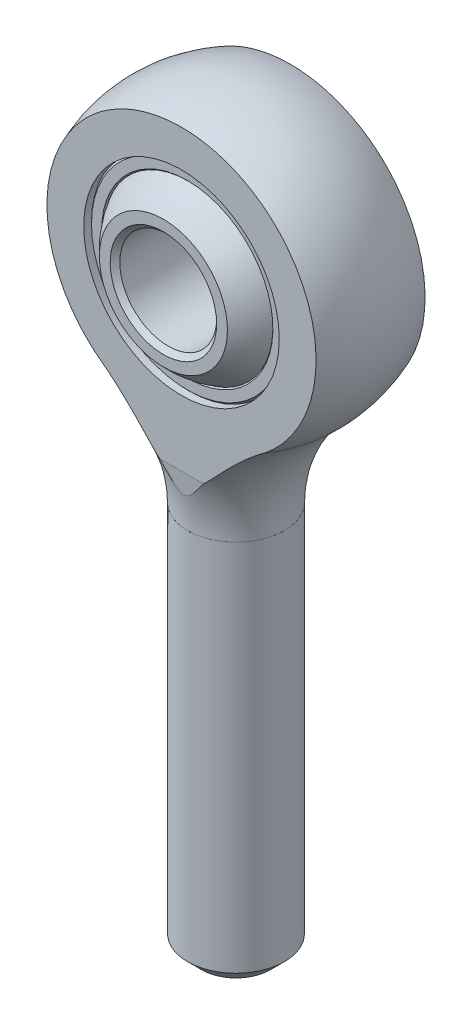
from build123d import *

# Parameters (mm, degrees)
SKETCH1_W               = 3.175
SKETCH1_H               = 25.4
CHAMFER2_SIZE           = 0.907142857
CUT_EXTRUDE1_DEPTH      = 29.750847814
CUT_EXTRUDE1_DEPTH_BACK = 29.750847814
CUT_EXTRUDE2_DEPTH      = 28.361772754
CUT_EXTRUDE2_DEPTH_BACK = 28.361772754
SKETCH6_R               = 6.4135
CUT_EXTRUDE3_DEPTH      = 28.86051193
CUT_EXTRUDE3_DEPTH_BACK = 28.86051193
SKETCH8_W               = 4.7625
SKETCH8_H               = 23.8125
CUT_EXTRUDE4_DEPTH      = 28.86051193
CUT_EXTRUDE4_DEPTH_BACK = 28.86051193
SKETCH10_R              = 3.175
CHAMFER1_SIZE           = 0.3175
CHAMFER3_SIZE           = 0.127
CHAMFER3_PART_2_SIZE    = 0.127
CHAMFER3_PART_2_SIZE2   = 0.092884709
CHAMFER4_SIZE           = 0.127
CHAMFER4_SIZE2          = 0.092884709
CHAMFER4_PART_2_SIZE    = 0.127


with BuildPart() as part:
    # Sketch1 → Revolve1 (revolve)
    with BuildSketch(Plane.XY):
        with Locations((1.5875, -12.7)):
            Rectangle(SKETCH1_W, SKETCH1_H)
    revolve(axis=Axis((0, 23.8125, 0), (0, -1, 0)))

    # Chamfer2
    chamfer2_edges = [part.edges().sort_by_distance(p)[0] for p in [
        (-3.175, -25.4, 0),
    ]]
    chamfer(chamfer2_edges, length=CHAMFER2_SIZE)


with BuildPart() as body_2:
    # Sketch4 → Revolve2 (revolve)
    with BuildSketch(Plane.XY):
        with BuildLine():
            Line((3.175, 0), (0, 0))
            Line((0, 0), (0, 23.8125))
            ThreePointArc((0, 23.8125), (8.890116899, 17.70677573), (6.382731959, 7.217396907))
            ThreePointArc((6.382731959, 7.217396907), (4.01304802, 3.949061991), (3.175, 0))
        make_face()
    revolve(axis=Axis((0, 23.8125, 0), (0, 1, 0)))

    # Sketch5 → Cut-Extrude1 (cut, two sides: drawn at the far end of the back side and taken through both)
    with BuildSketch(Plane(origin=(0, 0, 0), x_dir=(0, 0, -1), z_dir=(1, 0, 0)).offset(-CUT_EXTRUDE1_DEPTH_BACK)):
        Polygon((3.57505, 23.8125), (9.525, 23.8125), (9.525, 0), (3.175, 0), (3.57505, 3.57505), align=None)
        Polygon((-3.57505, 23.8125), (-3.57505, 3.57505), (-3.175, 0), (-9.525, 0), (-9.525, 23.8125), align=None)
    extrude(amount=CUT_EXTRUDE1_DEPTH + CUT_EXTRUDE1_DEPTH_BACK, mode=Mode.SUBTRACT)

    # Sketch6 → Cut-Extrude2 (cut, two sides: drawn at the far end of the back side and taken through both)
    with BuildSketch(Plane.XY.offset(-CUT_EXTRUDE2_DEPTH_BACK)):
        with Locations((0, 14.2875)):
            Circle(SKETCH6_R)
    extrude(amount=CUT_EXTRUDE2_DEPTH + CUT_EXTRUDE2_DEPTH_BACK, mode=Mode.SUBTRACT)


with BuildPart() as body_3:
    # Sketch7 → Revolve3 (revolve)
    with BuildSketch(Plane.XY):
        with BuildLine():
            Line((0, 20.6375), (0, 7.9375))
            ThreePointArc((0, 7.9375), (6.35, 14.2875), (0, 20.6375))
        make_face()
    revolve(axis=Axis((0, 0, 0), (0, 1, 0)))

    # Sketch8 → Cut-Extrude3 (cut, two sides: drawn at the far end of the back side and taken through both)
    with BuildSketch(Plane(origin=(0, 0, 0), x_dir=(0, 0, -1), z_dir=(1, 0, 0)).offset(-CUT_EXTRUDE3_DEPTH_BACK)):
        with Locations((-7.14375, 11.90625)):
            Rectangle(SKETCH8_W, SKETCH8_H)
        with Locations((7.14375, 11.90625)):
            Rectangle(SKETCH8_W, SKETCH8_H)
    extrude(amount=CUT_EXTRUDE3_DEPTH + CUT_EXTRUDE3_DEPTH_BACK, mode=Mode.SUBTRACT)

    # Sketch10 → Cut-Extrude4 (cut, two sides: drawn at the far end of the back side and taken through both)
    with BuildSketch(Plane.XY.offset(-CUT_EXTRUDE4_DEPTH_BACK)):
        with Locations((0, 14.2875)):
            Circle(SKETCH10_R)
    extrude(amount=CUT_EXTRUDE4_DEPTH + CUT_EXTRUDE4_DEPTH_BACK, mode=Mode.SUBTRACT)

    # Chamfer1
    chamfer1_edges = [body_3.edges().sort_by_distance(p)[0] for p in [
        (-3.175, 14.2875, -4.7625),
        (-3.175, 14.2875, 4.7625),
    ]]
    chamfer(chamfer1_edges, length=CHAMFER1_SIZE)


with BuildPart() as body_4:
    # Sketch14 → Revolve4 (revolve)
    with BuildSketch(Plane(origin=(0, 0, 0), x_dir=(0, 0, -1), z_dir=(1, 0, 0))):
        with BuildLine():
            Line((-3.19405, 20.701), (-3.19405, 19.775718709))
            ThreePointArc((-3.19405, 19.775718709), (-2.392542961, 20.169526707), (-1.543716214, 20.447))
            Line((-1.543716214, 20.447), (-1.543716214, 20.701))
            Line((-1.543716214, 20.701), (-3.19405, 20.701))
        make_face()
        with BuildLine():
            Line((3.19405, 19.775718709), (3.19405, 20.701))
            Line((3.19405, 20.701), (1.543716214, 20.701))
            Line((1.543716214, 20.701), (1.543716214, 20.447))
            ThreePointArc((1.543716214, 20.447), (2.392542961, 20.169526707), (3.19405, 19.775718709))
        make_face()
    revolve(axis=Axis((0, 14.2875, 4.7625), (0, 0, -1)))

    # Chamfer3
    chamfer3_edges = [body_4.edges().sort_by_distance(p)[0] for p in [
        (0, 7.874, 3.19405),
    ]]
    chamfer(chamfer3_edges, length=CHAMFER3_SIZE)

    # Chamfer3 part 2
    chamfer3_part_2_edges = [body_4.edges().sort_by_distance(p)[0] for p in [
        (0, 8.799281291, 3.19405),
    ]]
    chamfer3_part_2_side = [body_4.faces().sort_by_distance(p)[0] for p in [
        (0, 8.055401174, 3.19405),
    ]]
    chamfer(chamfer3_part_2_edges, length=CHAMFER3_PART_2_SIZE, length2=CHAMFER3_PART_2_SIZE2, reference=chamfer3_part_2_side[0])

    # Chamfer4
    chamfer4_edges = [body_4.edges().sort_by_distance(p)[0] for p in [
        (0, 8.799281291, -3.19405),
    ]]
    chamfer4_side = [body_4.faces().sort_by_distance(p)[0] for p in [
        (0, 8.405473293, -2.392542961),
    ]]
    chamfer(chamfer4_edges, length=CHAMFER4_SIZE, length2=CHAMFER4_SIZE2, reference=chamfer4_side[0])

    # Chamfer4 part 2
    chamfer4_part_2_edges = [body_4.edges().sort_by_distance(p)[0] for p in [
        (0, 7.874, -3.19405),
    ]]
    chamfer(chamfer4_part_2_edges, length=CHAMFER4_PART_2_SIZE)


solid = Compound([part.part, body_2.part, body_3.part, body_4.part])
